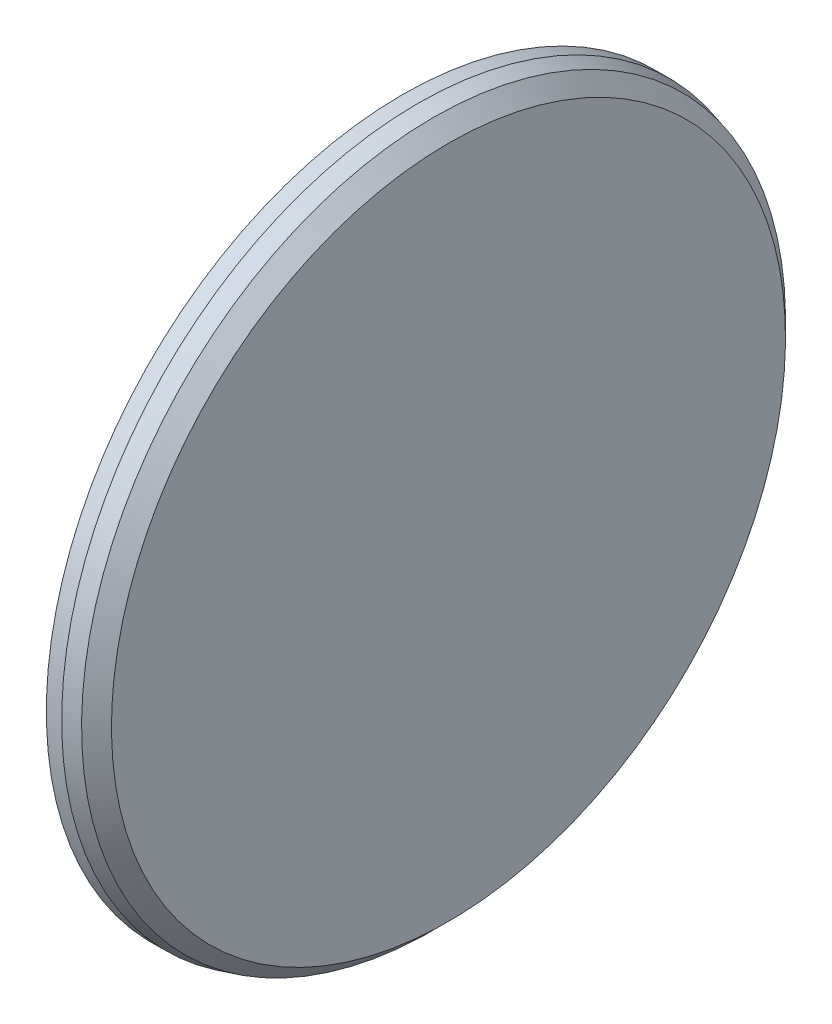
from build123d import *

# Parameters (mm, degrees)
BOSS_EXTRUDE1_START = 20
BOSS_EXTRUDE1_DEPTH = 20
CIRPATTERN1_COUNT   = 9


with BuildPart() as part:
    # Sketch1 → Revolve1 (revolve)
    with BuildSketch(Plane.XY):
        Polygon((-50, 0), (-50, 100), (0, 100), (0, 420), (-30, 420), (-30, 465), (-10, 465), (10.490381057, 459.509618943), (30, 440), (30, 0), align=None)
    revolve(axis=Axis((30, 0, 0), (-1, 0, 0)))

    # Sketch2 → Boss-Extrude1 (add)
    with BuildSketch(Plane.ZY.offset(BOSS_EXTRUDE1_START)):
        with BuildLine():
            ThreePointArc((27.272727273, 96.209138584), (22.022759648, 99.799825551), (20, 105.830052443))
            Line((20, 105.830052443), (20, 408.900966005))
            ThreePointArc((20, 408.900966005), (23.192543543, 416.226164746), (30.731707317, 418.874160298))
            ThreePointArc((30.731707317, 418.874160298), (5.43490171, 419.964834056), (-19.881656805, 419.529164329))
            ThreePointArc((-19.881656805, 419.529164329), (-56.82924306, 416.1375219), (-93.333333333, 409.498338078))
            ThreePointArc((-93.333333333, 409.498338078), (-42.583426132, 397.902733094), (-20, 350.998575496))
            Line((-20, 350.998575496), (-20, 105.830052443))
            ThreePointArc((-20, 105.830052443), (-22.022759648, 99.799825551), (-27.272727273, 96.209138584))
            ThreePointArc((-27.272727273, 96.209138584), (0, 100), (27.272727273, 96.209138584))
        make_face()
    boss_extrude1 = extrude(amount=-BOSS_EXTRUDE1_DEPTH)

    # CirPattern1: Boss-Extrude1 ×9 about axis
    cirpattern1_axis = Axis((0, 0, 0), (1, 0, 0))
    for i in range(1, CIRPATTERN1_COUNT):
        add(boss_extrude1.rotate(cirpattern1_axis, i * 360 / CIRPATTERN1_COUNT))


solid = part.part
